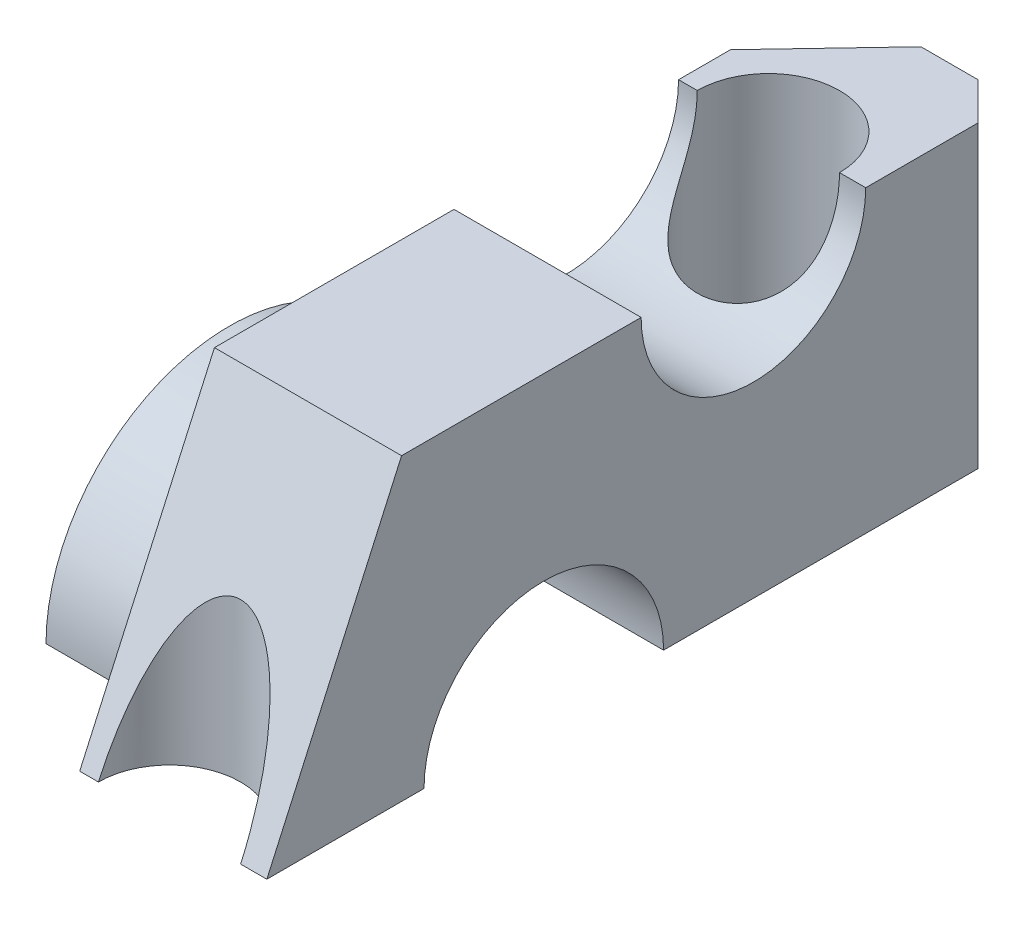
from build123d import *

# Parameters (mm, degrees)
SALIENTE_EXTRUIR1_DEPTH    = 25
CORTAR_EXTRUIR1_START      = -94
CROQUIS2_R                 = 9.5
CORTAR_EXTRUIR1_DEPTH      = 148
CROQUIS3_R                 = 15
CROQUIS3_R_2               = 16
CORTAR_EXTRUIR2_DEPTH      = 94
CORTAR_EXTRUIR3_DEPTH      = 94
CHAFL_N2_SIZE              = 5
SALIENTE_EXTRUIR2_DEPTH    = 17
CHAFL_N2_OF_SIMETR_A1_SIZE = 5
CROQUIS6_W                 = 120.154705919
CROQUIS6_H                 = 59.700185721
CORTAR_EXTRUIR4_DEPTH      = 90


with BuildPart() as part:
    # Croquis1 → Saliente-Extruir1 (new body)
    with BuildSketch(Plane(origin=(0, 0, 0), x_dir=(0, 0, -1), z_dir=(1, 0, 0))):
        Polygon((-100, 0), (-82, 40), (0, 40), (0, 0), align=None)
    saliente_extruir1 = extrude(amount=SALIENTE_EXTRUIR1_DEPTH)

    # Croquis2 → Cortar-Extruir1 (cut)
    with BuildSketch(Plane(origin=(0, 40, 0), x_dir=(1, 0, 0), z_dir=(0, 1, 0)).offset(CORTAR_EXTRUIR1_START)):
        with Locations((13, -100)):
            Circle(CROQUIS2_R)
        with Locations((13, -20)):
            Circle(CROQUIS2_R)
    cortar_extruir1 = extrude(amount=CORTAR_EXTRUIR1_DEPTH, mode=Mode.SUBTRACT)

    # Croquis3 → Cortar-Extruir2 (cut, symmetric)
    with BuildSketch(Plane(origin=(25, 0, 0), x_dir=(0, 0, -1), z_dir=(1, 0, 0))):
        with Locations((-35, 40)):
            Circle(CROQUIS3_R)
        with Locations((-63, 0)):
            Circle(CROQUIS3_R_2)
    cortar_extruir2 = extrude(amount=CORTAR_EXTRUIR2_DEPTH, both=True, mode=Mode.SUBTRACT)

    # Croquis4 → Cortar-Extruir3 (cut, symmetric)
    with BuildSketch(Plane(origin=(0, 40, 0), x_dir=(1, 0, 0), z_dir=(0, 1, 0))):
        Polygon((12.62, 0), (25, -13.066583333), (25, 0), align=None)
    cortar_extruir3 = extrude(amount=CORTAR_EXTRUIR3_DEPTH, both=True, mode=Mode.SUBTRACT)

    # Chaflán2
    chafl_n2_edges = [part.edges().sort_by_distance(p)[0] for p in [
        (0, 20, 0),
    ]]
    chamfer(chafl_n2_edges, length=CHAFL_N2_SIZE)

    # Croquis5 → Saliente-Extruir2 (add)
    with BuildSketch(Plane(origin=(25, 0, 0), x_dir=(0, 0, -1), z_dir=(1, 0, 0))):
        with BuildLine():
            Line((-87.5, 0), (-83, 0))
            ThreePointArc((-83, 0), (-63, 20), (-43, 0))
            Line((-43, 0), (-38.5, 0))
            ThreePointArc((-38.5, 0), (-63, 24.5), (-87.5, 0))
        make_face()
    saliente_extruir2 = extrude(amount=SALIENTE_EXTRUIR2_DEPTH)


with BuildPart() as simetr_a1_1:
    # Simetría1: Saliente-Extruir1 across plane
    add(saliente_extruir1.mirror(Plane(origin=(0, 0, 0), x_dir=(0, 0, 1), z_dir=(1, 0, 0))))

    # Simetr_a1 2: Cortar-Extruir1, Cortar-Extruir2, Cortar-Extruir3 across plane
    add(cortar_extruir1.mirror(Plane(origin=(0, 0, 0), x_dir=(0, 0, 1), z_dir=(1, 0, 0))), mode=Mode.SUBTRACT)
    add(cortar_extruir2.mirror(Plane(origin=(0, 0, 0), x_dir=(0, 0, 1), z_dir=(1, 0, 0))), mode=Mode.SUBTRACT)
    add(cortar_extruir3.mirror(Plane(origin=(0, 0, 0), x_dir=(0, 0, 1), z_dir=(1, 0, 0))), mode=Mode.SUBTRACT)

    # Chaflán2 of Simetría1
    chafl_n2_of_simetr_a1_edges = [simetr_a1_1.edges().sort_by_distance(p)[0] for p in [
        (0, 20, 0),
    ]]
    chamfer(chafl_n2_of_simetr_a1_edges, length=CHAFL_N2_OF_SIMETR_A1_SIZE)


with BuildPart() as simetr_a1_3_1:
    # Simetr_a1 3: Saliente-Extruir2 across plane
    add(saliente_extruir2.mirror(Plane(origin=(0, 0, 0), x_dir=(0, 0, 1), z_dir=(1, 0, 0))))


with BuildPart() as part_1:
    add(part.part)

    # Simetría1 united with what the copies to: union Simetría1_1, Simetría1 3_1
    add(simetr_a1_1.part)
    add(simetr_a1_3_1.part)

    # Croquis6 → Cortar-Extruir4 (cut)
    with BuildSketch(Plane(origin=(0, 0, 0), x_dir=(0, 0, -1), z_dir=(1, 0, 0))):
        with Locations((-45.74339831, 19.581609369)):
            Rectangle(CROQUIS6_W, CROQUIS6_H)
    extrude(amount=CORTAR_EXTRUIR4_DEPTH, mode=Mode.SUBTRACT)


solid = part_1.part
